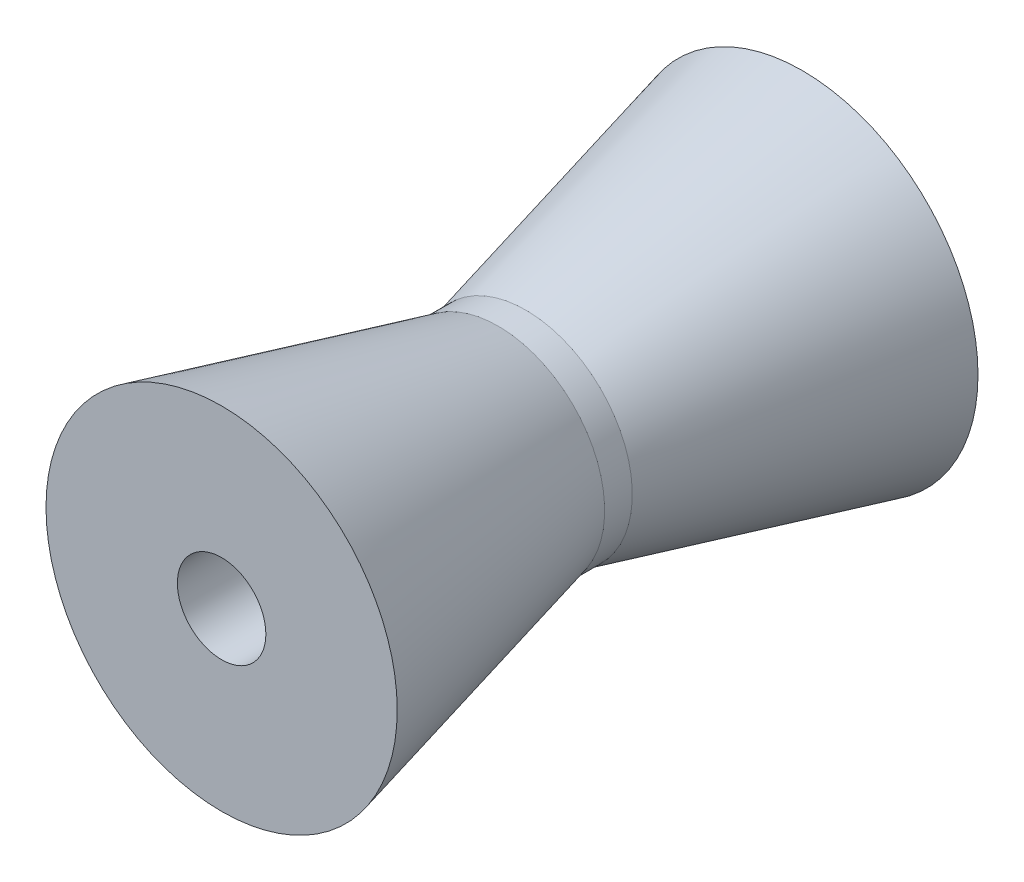
from build123d import *

# Parameters (mm, degrees)
ESQUISSE1_R        = 4.8895
ESQUISSE1_R_2      = 2.032
BOSS_EXTRU_1_DEPTH = 13.335


with BuildPart() as part:
    # Esquisse1 → Boss.-Extru.1 (new, symmetric)
    with BuildSketch(Plane.XY):
        Circle(ESQUISSE1_R)
        Circle(ESQUISSE1_R_2, mode=Mode.SUBTRACT)
    extrude(amount=BOSS_EXTRU_1_DEPTH, both=True)

    # Esquisse2 → Révolution1 (revolve)
    with BuildSketch(Plane(origin=(0, 0, 0), x_dir=(0, 0, -1), z_dir=(1, 0, 0)), mode=Mode.PRIVATE) as r_volution1_sk:
        Polygon((-0.635, 4.8895), (-13.335, 8.0645), (-13.335, 4.8895), align=None)
    r_volution1 = revolve(r_volution1_sk.sketch.rotate(Axis((0, 0, 0), (0, 0, 1)), 90), axis=Axis((0, 0, 0), (0, 0, 1)))

    # Symétrie1: Révolution1 across plane
    add(r_volution1.mirror(Plane.XY))


solid = part.part
